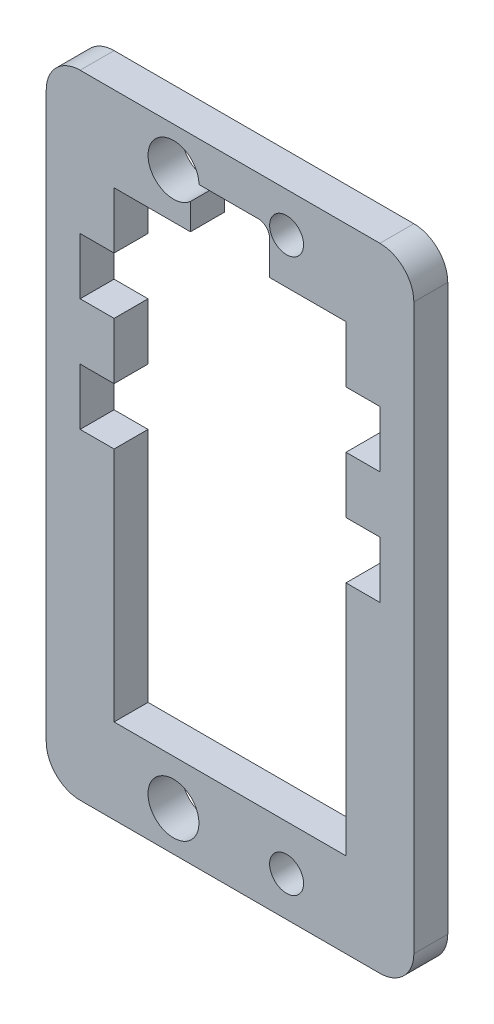
from build123d import *

# Parameters (mm, degrees)
SKETCH1_R           = 1.5
SKETCH1_R_2         = 2.25
BOSS_EXTRUDE1_DEPTH = 3


with BuildPart() as part:
    # Sketch1 → Boss-Extrude1 (new body)
    with BuildSketch(Plane.XY):
        with BuildLine():
            Line((-13.25, 27.95), (13.25, 27.95))
            ThreePointArc((13.25, 27.95), (15.371320344, 27.071320344), (16.25, 24.95))
            Line((16.25, 24.95), (16.25, -24.95))
            ThreePointArc((16.25, -24.95), (15.371320344, -27.071320344), (13.25, -27.95))
            Line((13.25, -27.95), (-13.25, -27.95))
            ThreePointArc((-13.25, -27.95), (-15.371320344, -27.071320344), (-16.25, -24.95))
            Line((-16.25, -24.95), (-16.25, 24.95))
            ThreePointArc((-16.25, 24.95), (-15.371320344, 27.071320344), (-13.25, 27.95))
        make_face()
        with Locations((5, 24.45)):
            Circle(SKETCH1_R, mode=Mode.SUBTRACT)
        with Locations(Location((5, -24.45, 0), (0, 0, 180))):
            Circle(SKETCH1_R, mode=Mode.SUBTRACT)
        with Locations(Location((-5, -24.45, 0), (0, 0, 180))):
            Circle(SKETCH1_R_2, mode=Mode.SUBTRACT)
        with BuildLine():
            Line((-10.25, 20.45), (-3.5, 20.45))
            Line((-3.5, 20.45), (-3.5, 22.772949017))
            ThreePointArc((-3.5, 22.772949017), (-7.053959591, 25.368558654), (-2.75, 24.45))
            Line((-2.75, 24.45), (2.5, 24.45))
            ThreePointArc((2.5, 24.45), (3.207106781, 24.157106781), (3.5, 23.45))
            Line((3.5, 23.45), (3.5, 20.45))
            Line((3.5, 20.45), (10.25, 20.45))
            Line((10.25, 20.45), (10.25, 15.45))
            Line((10.25, 15.45), (13.25, 15.45))
            Line((13.25, 15.45), (13.25, 10.45))
            Line((13.25, 10.45), (10.25, 10.45))
            Line((10.25, 10.45), (10.25, 5.45))
            Line((10.25, 5.45), (13.25, 5.45))
            Line((13.25, 5.45), (13.25, 0.45))
            Line((13.25, 0.45), (10.25, 0.45))
            Line((10.25, 0.45), (10.25, -20.45))
            Line((10.25, -20.45), (-10.25, -20.45))
            Line((-10.25, -20.45), (-10.25, 0.45))
            Line((-10.25, 0.45), (-13.25, 0.45))
            Line((-13.25, 0.45), (-13.25, 5.45))
            Line((-13.25, 5.45), (-10.25, 5.45))
            Line((-10.25, 5.45), (-10.25, 10.45))
            Line((-10.25, 10.45), (-13.25, 10.45))
            Line((-13.25, 10.45), (-13.25, 15.45))
            Line((-13.25, 15.45), (-10.25, 15.45))
            Line((-10.25, 15.45), (-10.25, 20.45))
        make_face(mode=Mode.SUBTRACT)
    extrude(amount=BOSS_EXTRUDE1_DEPTH)


solid = part.part
